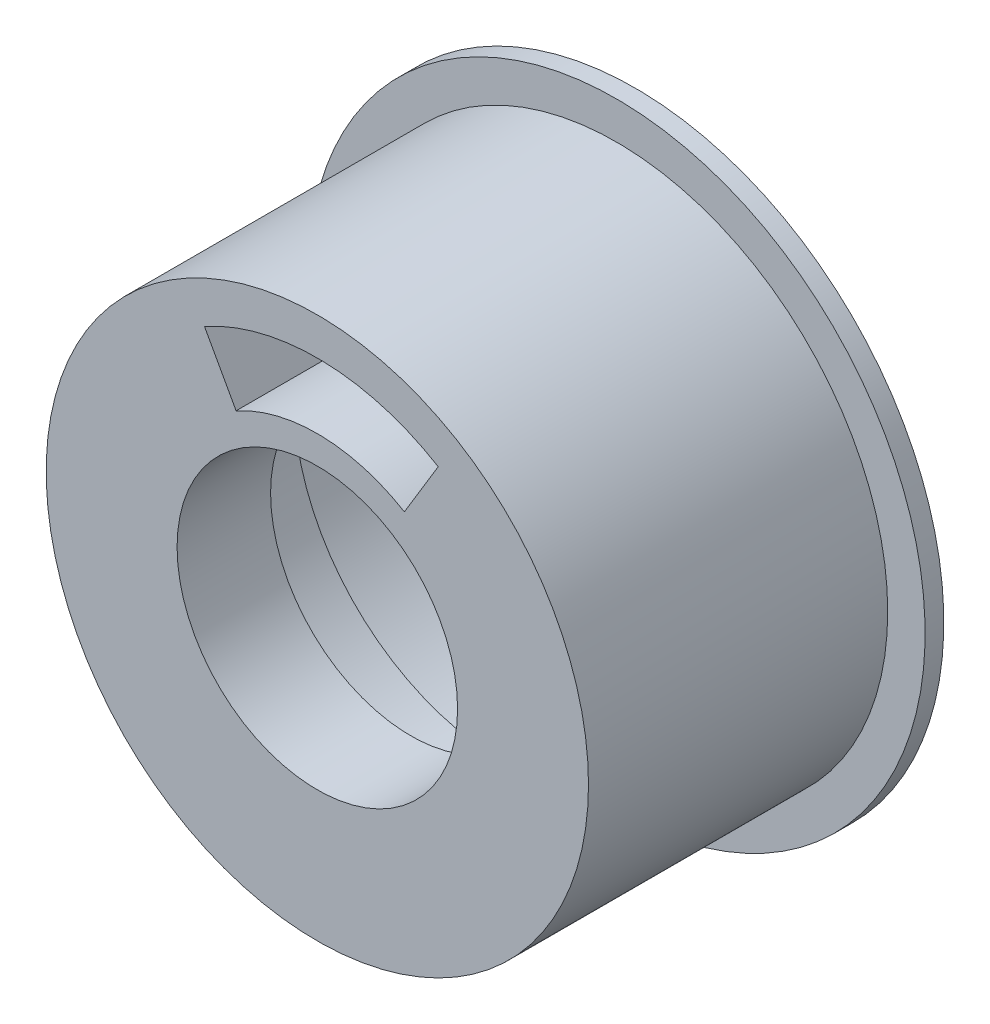
from build123d import *

# Parameters (mm, degrees)
SKETCH_1_R          = 29
SKETCH_1_R_2        = 26
EXTRUDE_1_DEPTH     = 12
SKETCH_2_R          = 29
SKETCH_2_R_2        = 22.5
EXTRUDE_2_DEPTH     = 10
SKETCH_3_R          = 29
SKETCH_3_R_2        = 15
EXTRUDE_3_DEPTH     = 10
CUT_EXTRUDE_1_DEPTH = 33
EXTRUDE_START       = 2
SKETCH_5_R          = 33
SKETCH_5_R_2        = 26
EXTRUDE_4_DEPTH     = 2


with BuildPart() as part:
    # 草图1 → 凸台-拉伸1 (new body)
    with BuildSketch(Plane.XY):
        Circle(SKETCH_1_R)
        Circle(SKETCH_1_R_2, mode=Mode.SUBTRACT)
    extrude(amount=EXTRUDE_1_DEPTH)

    # 草图2 → 凸台-拉伸2 (add)
    with BuildSketch(Plane.XY.offset(12)):
        Circle(SKETCH_2_R)
        Circle(SKETCH_2_R_2, mode=Mode.SUBTRACT)
    extrude(amount=EXTRUDE_2_DEPTH)

    # 草图3 → 凸台-拉伸3 (add)
    with BuildSketch(Plane.XY.offset(22)):
        Circle(SKETCH_3_R)
        Circle(SKETCH_3_R_2, mode=Mode.SUBTRACT)
    extrude(amount=EXTRUDE_3_DEPTH)

    # 草图4 → 切除-拉伸1 (cut)
    with BuildSketch(Plane.XY.offset(32)):
        with BuildLine():
            Line((9.306782311, 15.407264618), (12.926086543, 21.398978637))
            ThreePointArc((12.926086543, 21.398978637), (0.494829999, 24.995102386), (-12.069015843, 21.893808636))
            Line((-12.069015843, 21.893808636), (-8.689691407, 15.763542218))
            ThreePointArc((-8.689691407, 15.763542218), (0.3562776, 17.996473718), (9.306782311, 15.407264618))
        make_face()
    extrude(amount=-CUT_EXTRUDE_1_DEPTH, mode=Mode.SUBTRACT)

    # 草图5 → 凸台-拉伸4 (add)
    with BuildSketch(Plane(origin=(0, 0, 0), x_dir=(-1, 0, 0), z_dir=(0, 0, -1)).offset(EXTRUDE_START)):
        Circle(SKETCH_5_R)
        Circle(SKETCH_5_R_2, mode=Mode.SUBTRACT)
    extrude(amount=-EXTRUDE_4_DEPTH)


solid = part.part
